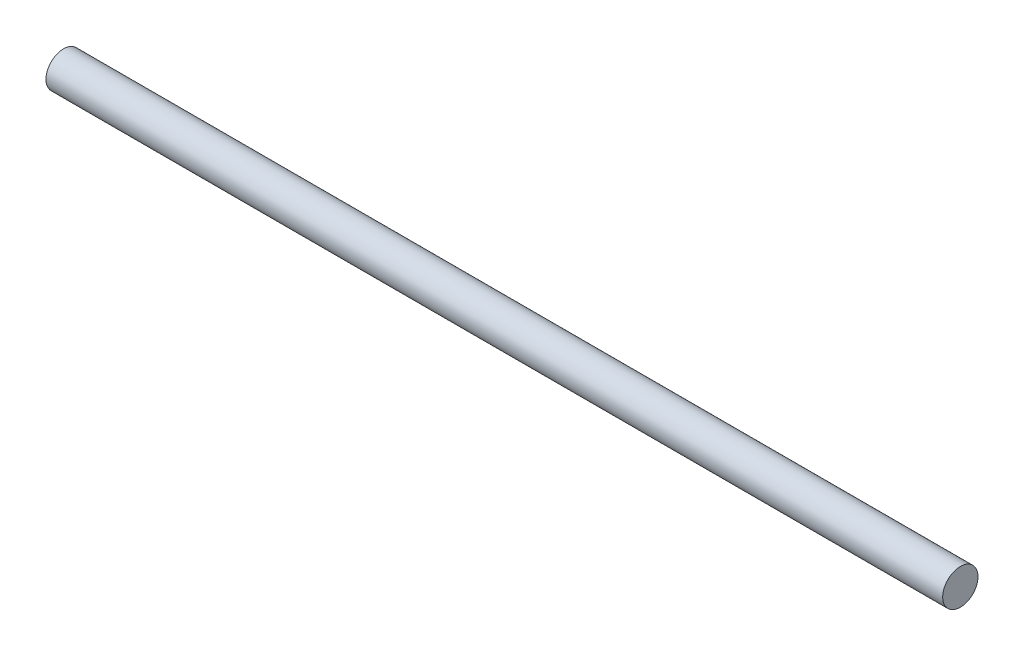
from build123d import *

# Parameters (mm, degrees)
SKETCH1_R           = 6
BOSS_EXTRUDE1_DEPTH = 304.54


with BuildPart() as part:
    # Sketch1 → Boss-Extrude1 (new body)
    with BuildSketch(Plane.YZ):
        with Locations(Location((-26.294909659, 30.041847063, 0), (0, 0, 270))):
            Circle(SKETCH1_R)
    extrude(amount=BOSS_EXTRUDE1_DEPTH)


solid = part.part
